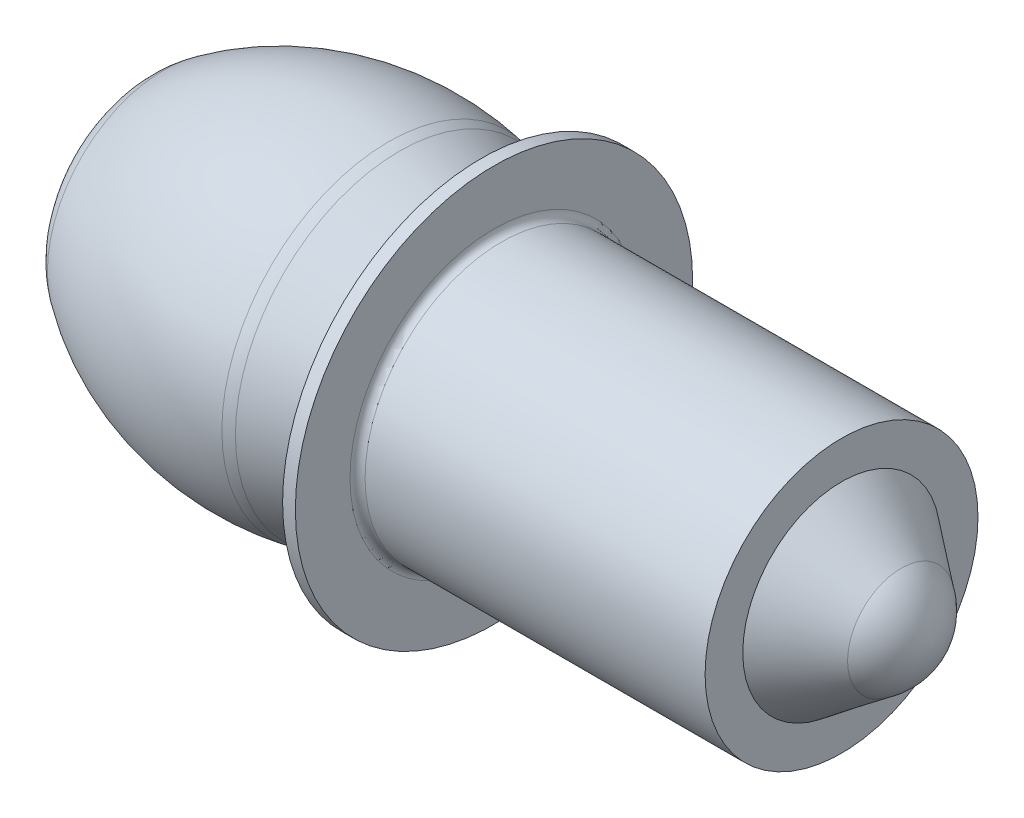
from build123d import *


with BuildPart() as part:
    # Sketch1 → Revolve7 (revolve)
    with BuildSketch(Plane.XY, mode=Mode.PRIVATE) as revolve7_sk:
        with BuildLine():
            Line((10.276772921, 1.166214565), (13.032359095, 2.0955))
            Line((13.032359095, 2.0955), (13.032359095, 0))
            Line((13.032359095, 0), (13.462, 0))
            Line((13.462, 0), (13.462, 1.8415))
            ThreePointArc((13.462, 1.8415), (13.536394878, 2.021105122), (13.716, 2.0955))
            Line((13.716, 2.0955), (25.1714, 2.0955))
            Line((25.1714, 2.0955), (25.1714, 3.3655))
            Line((25.1714, 3.3655), (27.178, 4.8895))
            ThreePointArc((27.178, 4.8895), (27.914506706, 5.666579226), (28.2194, 6.6929))
            Line((28.2194, 6.6929), (1.27, 6.6929))
            Line((1.27, 6.6929), (0.155422631, 6.6929))
            Line((0.155422631, 6.6929), (0.155422631, 6.662703245))
            ThreePointArc((0.155422631, 6.662703245), (0.183846403, 6.474846172), (0.266573119, 6.303806757))
            Line((0.266573119, 6.303806757), (0.906722652, 5.36943701))
            ThreePointArc((0.906722652, 5.36943701), (1.160671231, 4.899340794), (1.310662302, 4.386522101))
            ThreePointArc((1.310662302, 4.386522101), (1.666264155, 3.476843471), (2.338850191, 2.768609109))
            ThreePointArc((2.338850191, 2.768609109), (5.95509585, 1.158024647), (9.912867233, 1.072815189))
            ThreePointArc((9.912867233, 1.072815189), (10.096549324, 1.112777329), (10.276772921, 1.166214565))
        make_face()
    revolve(revolve7_sk.sketch.rotate(Axis((0, 6.6929, 0), (1, 0, 0)), 270), axis=Axis((0, 6.6929, 0), (1, 0, 0)))


solid = part.part
